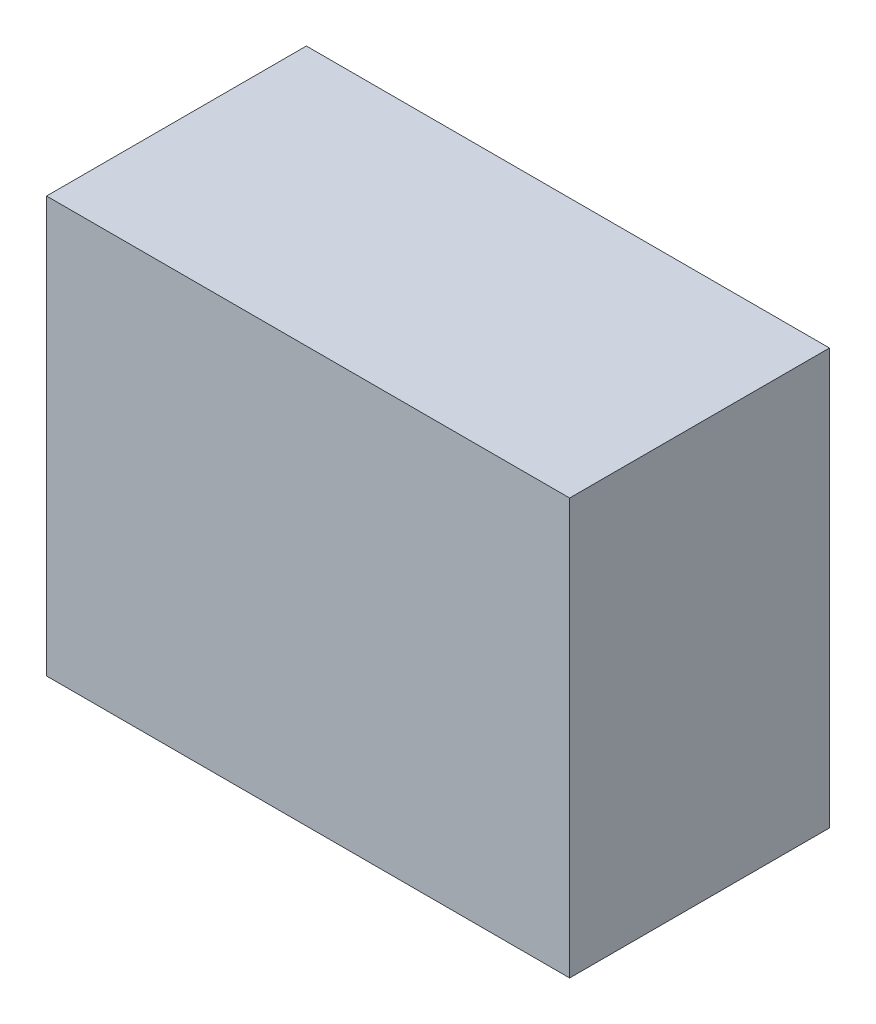
from build123d import *

# Parameters (mm, degrees)
SKETCH_1_W      = 151
SKETCH_1_H      = 120
EXTRUDE_1_DEPTH = 75


with BuildPart() as part:
    # 草图1 → 凸台-拉伸1 (new body)
    with BuildSketch(Plane(origin=(0, 0, 0), x_dir=(-1, 0, 0), z_dir=(0, 0, -1))):
        Rectangle(SKETCH_1_W, SKETCH_1_H)
    extrude(amount=-EXTRUDE_1_DEPTH)


solid = part.part
